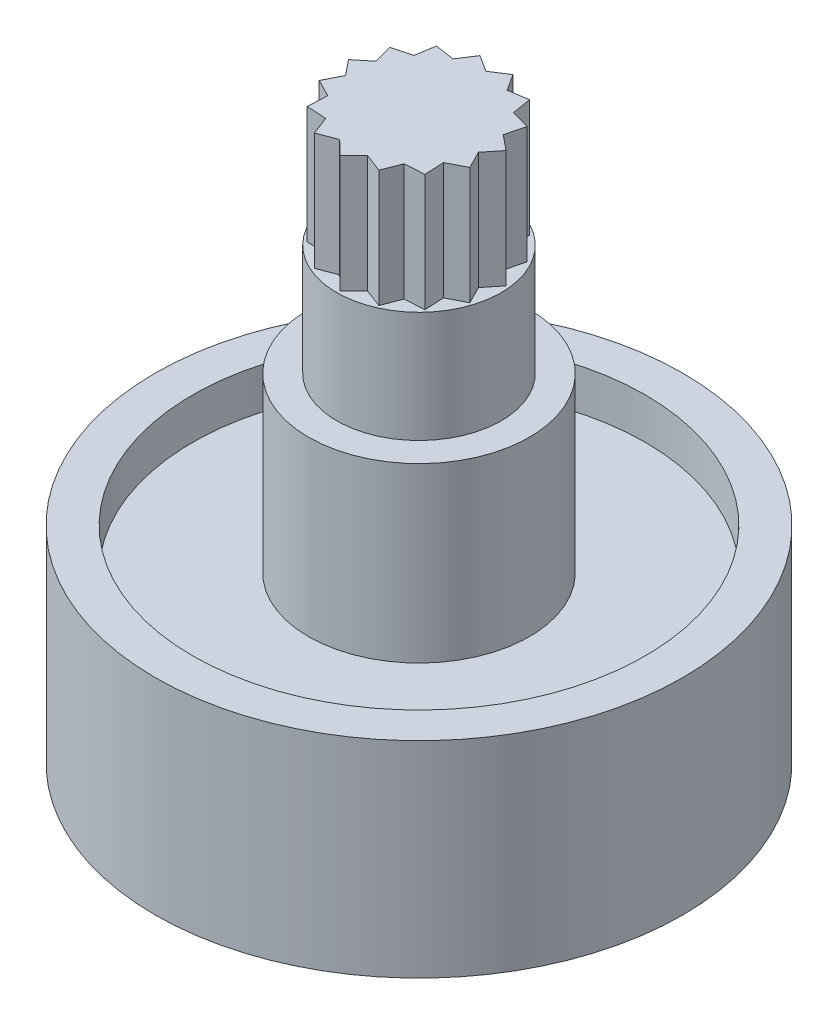
from build123d import *

# Parameters (mm, degrees)
CUT_EXTRUDE1_DEPTH = 5.7
CIRPATTERN1_COUNT  = 15


with BuildPart() as part:
    # Sketch1 → 52 Tooth (revolve)
    with BuildSketch(Plane.XY, mode=Mode.PRIVATE) as f_52_tooth_sk:
        Polygon((12.827, 0), (12.827, 10), (11, 10), (11, 8), (5.375, 8), (5.375, 16.4), (4, 16.4), (4, 21.8), (3.85, 21.8), (3.85, 27.5), (0, 27.5), (0, 14.75), (3.55, 14.75), (3.55, 3.5), (7, 3.5), (7, 0), align=None)
    revolve(f_52_tooth_sk.sketch.rotate(Axis((0, 0, 0), (0, 1, 0)), 90), axis=Axis((0, 0, 0), (0, 1, 0)))

    # Sketch2 → Cut-Extrude1 (cut)
    with BuildSketch(Plane(origin=(0, 27.5, 0), x_dir=(1, 0, 0), z_dir=(0, 1, 0))):
        with BuildLine():
            ThreePointArc((0.80046001, 3.765868263), (0, 3.85), (-0.80046001, 3.765868263))
            Line((-0.80046001, 3.765868263), (0, 3.25))
            Line((0, 3.25), (0.80046001, 3.765868263))
        make_face()
    cut_extrude1 = extrude(amount=-CUT_EXTRUDE1_DEPTH, mode=Mode.SUBTRACT)

    # CirPattern1: Cut-Extrude1 ×15 about axis
    cirpattern1_axis = Axis((0, 0, 0), (0, 1, 0))
    for i in range(1, CIRPATTERN1_COUNT):
        add(cut_extrude1.rotate(cirpattern1_axis, i * 360 / CIRPATTERN1_COUNT), mode=Mode.SUBTRACT)


solid = part.part
